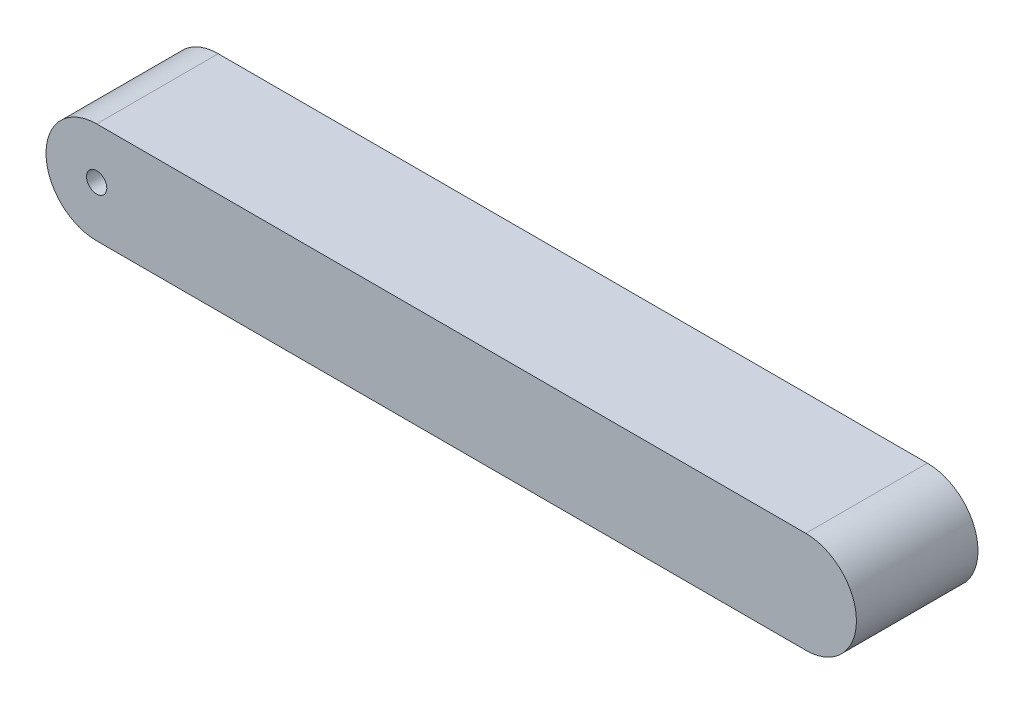
from build123d import *

# Parameters (mm, degrees)
SKETCH_1_R      = 5
EXTRUDE_1_DEPTH = 60


with BuildPart() as part:
    # 草图1 → 凸台-拉伸1 (new body)
    with BuildSketch(Plane.XY):
        with BuildLine():
            Line((0, 0), (350, 0))
            ThreePointArc((350, 0), (375, 25), (350, 50))
            Line((350, 50), (0, 50))
            ThreePointArc((0, 50), (-25, 25), (0, 0))
        make_face()
        with Locations((0, 25)):
            Circle(SKETCH_1_R, mode=Mode.SUBTRACT)
    extrude(amount=EXTRUDE_1_DEPTH)


solid = part.part
